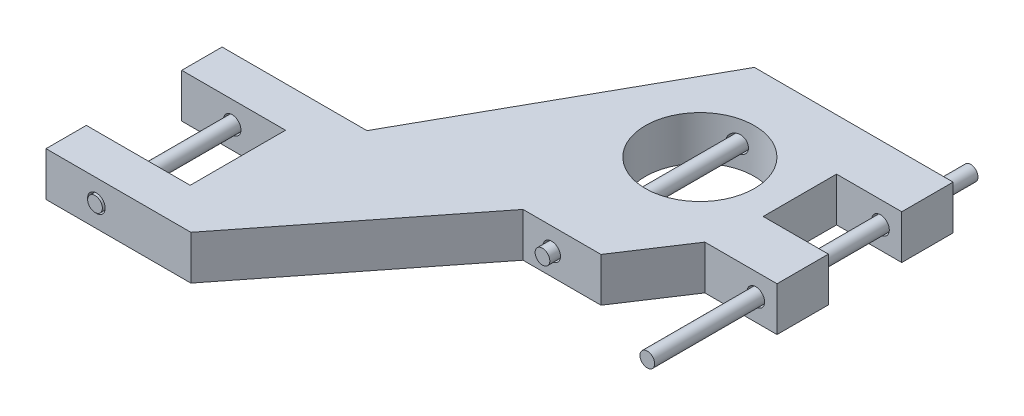
from build123d import *

# Parameters (mm, degrees)
SKETCH21_R         = 9.436937722
EXTRUDE1_DEPTH     = 3.81
SKETCH22_R         = 1.524
CUT_EXTRUDE1_DEPTH = 91.7575
EXTRUDE2_START     = 10.16
SKETCH24_R         = 1.27
EXTRUDE2_DEPTH     = 40.005
EXTRUDE3_START     = 16.51
SKETCH24_3_R       = 1.27
EXTRUDE3_DEPTH     = 55.974
EXTRUDE4_START     = 12.7
SKETCH24_4_R       = 1.27
EXTRUDE4_DEPTH     = 28.288


with BuildPart() as part:
    # Sketch21 → Extrude1 (new, symmetric)
    with BuildSketch(Plane(origin=(0, 0, 0), x_dir=(1, 0, 0), z_dir=(0, 1, 0))):
        Polygon((-25.235563568, 32.747037143), (9.156953986, 32.747037143), (9.156953986, 23.857037143), (-2.129946458, 23.857037143), (-2.129946458, 11.157037143), (9.156953986, 11.157037143), (9.156953986, 2.267037143), (-3.333838084, 2.267037143), (-10.476047059, -8.570931995), (-23.974524178, -8.570931995), (-49.288929698, -40.750763377), (-74.36445975, -40.750763377), (-74.36445975, -33.765763377), (-56.396654351, -33.765763377), (-56.396654351, -17.255763377), (-74.36445975, -17.255763377), (-74.36445975, -10.270763377), (-49.288929698, -10.270763377), align=None)
        with Locations((-16.513065154, 14.584522986)):
            Circle(SKETCH21_R, mode=Mode.SUBTRACT)
    extrude(amount=EXTRUDE1_DEPTH, both=True)

    # Sketch22 → Cut-Extrude1 (cut, symmetric)
    with BuildSketch(Plane(origin=(0, 0, 0), x_dir=(-1, 0, 0), z_dir=(0, 0, -1))):
        with Locations((-5.47919097, 0)):
            Circle(SKETCH22_R)
        with Locations((65.64080903, 0)):
            Circle(SKETCH22_R)
        with Locations((19.01714802, 0)):
            Circle(SKETCH22_R)
    extrude(amount=CUT_EXTRUDE1_DEPTH, both=True, mode=Mode.SUBTRACT)


with BuildPart() as body_2:
    # Sketch24 → Extrude2 (new body)
    with BuildSketch(Plane.XY.offset(EXTRUDE2_START)):
        with Locations((-19.01714802, 0)):
            Circle(SKETCH24_R)
    extrude(amount=-EXTRUDE2_DEPTH)


with BuildPart() as body_3:
    # Sketch24<3> → Extrude3 (new body)
    with BuildSketch(Plane.XY.offset(EXTRUDE3_START)):
        with Locations((5.47919097, 0)):
            Circle(SKETCH24_3_R)
    extrude(amount=-EXTRUDE3_DEPTH)


with BuildPart() as body_4:
    # Sketch24<4> → Extrude4 (new body)
    with BuildSketch(Plane.XY.offset(EXTRUDE4_START)):
        with Locations((-65.64080903, 0)):
            Circle(SKETCH24_4_R)
    extrude(amount=EXTRUDE4_DEPTH)


solid = Compound([part.part, body_2.part, body_3.part, body_4.part])
